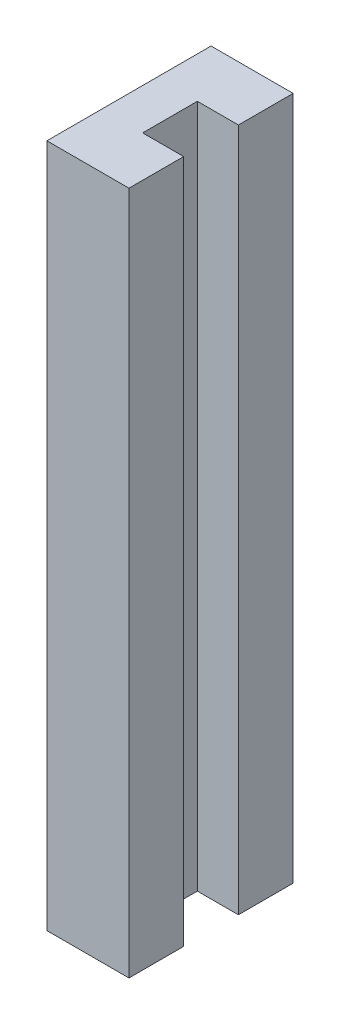
from build123d import *

# Parameters (mm, degrees)
BOSS_EXTRUDE1_DEPTH = 50


with BuildPart() as part:
    # Sketch1 → Boss-Extrude1 (new body)
    with BuildSketch(Plane(origin=(0, 0, 0), x_dir=(1, 0, 0), z_dir=(0, 1, 0))):
        Polygon((0, 0), (0, -12), (6, -12), (6, -8), (3, -8), (3, -4), (6, -4), (6, 0), align=None)
    extrude(amount=BOSS_EXTRUDE1_DEPTH)


solid = part.part
